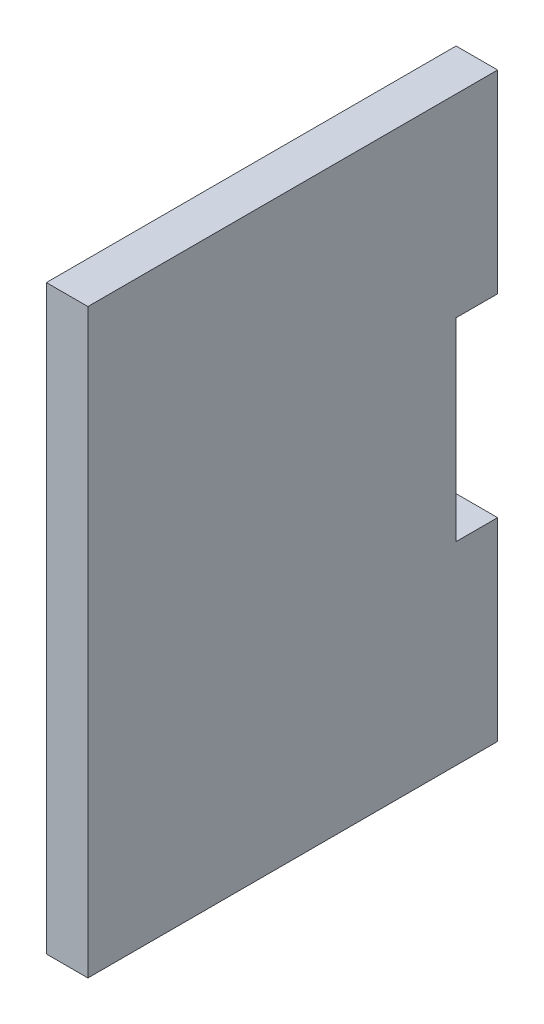
from build123d import *

# Parameters (mm, degrees)
SKETCH1_W           = 28.1432
SKETCH1_H           = 44.45
SKETCH1_W_2         = 3.175
SKETCH1_H_2         = 14.816666667
BOSS_EXTRUDE1_DEPTH = 3.175


with BuildPart() as part:
    # Sketch1 → Boss-Extrude1 (new body)
    with BuildSketch(Plane(origin=(0, 0, 0), x_dir=(0, 0, -1), z_dir=(1, 0, 0))):
        with Locations((14.0716, 22.225)):
            Rectangle(SKETCH1_W, SKETCH1_H)
        with Locations((29.7307, 37.041666667)):
            Rectangle(SKETCH1_W_2, SKETCH1_H_2)
        with Locations((29.7307, 7.408333334)):
            Rectangle(SKETCH1_W_2, SKETCH1_H_2)
    extrude(amount=BOSS_EXTRUDE1_DEPTH)


solid = part.part
